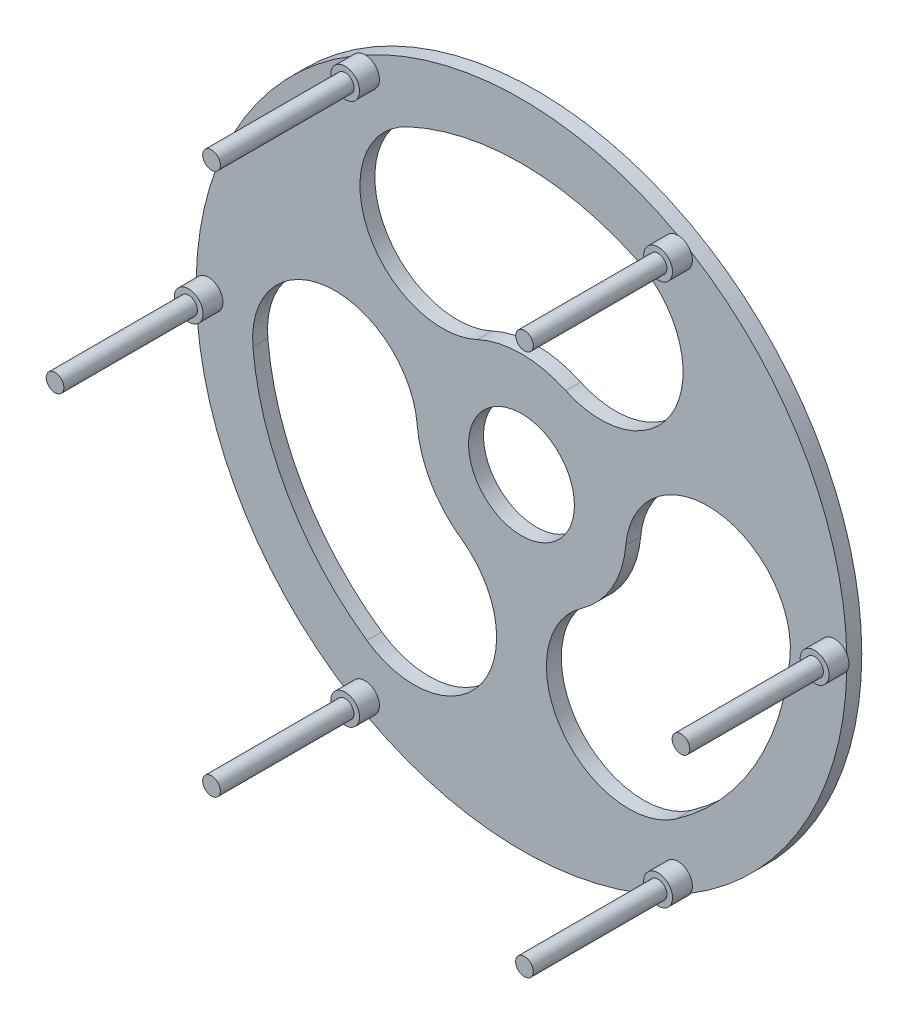
from build123d import *

# Parameters (mm, degrees)
SKETCH_1_R          = 65.5
EXTRUDE_1_DEPTH     = 3
SKETCH_2_R          = 2.9
EXTRUDE_2_DEPTH     = 4
SKETCH_3_R          = 10.65
CUT_EXTRUDE_1_DEPTH = 94.00032258
SKETCH_4_R          = 1.777177549
EXTRUDE_3_DEPTH     = 26.9
CUT_EXTRUDE_2_DEPTH = 98.917669498


with BuildPart() as part:
    # 草图1 → 凸台-拉伸1 (new body)
    with BuildSketch(Plane.XY):
        Circle(SKETCH_1_R)
    extrude(amount=-EXTRUDE_1_DEPTH)

    # 草图2 → 凸台-拉伸2 (add)
    with BuildSketch(Plane.XY):
        with Locations(Location((-63, 0, 0), (0, 0, 148.88786163))):
            Circle(SKETCH_2_R)
        with Locations(Location((-31.5, 54.559600438, 0), (0, 0, 151.11213837))):
            Circle(SKETCH_2_R)
        with Locations(Location((31.5, 54.559600438, 0), (0, 0, 91.11213837))):
            Circle(SKETCH_2_R)
        with Locations(Location((63, 0, 0), (0, 0, 31.11213837))):
            Circle(SKETCH_2_R)
        with Locations(Location((31.5, -54.559600438, 0), (0, 0, 268.88786163))):
            Circle(SKETCH_2_R)
        with Locations(Location((-31.5, -54.559600438, 0), (0, 0, 208.88786163))):
            Circle(SKETCH_2_R)
    extrude(amount=EXTRUDE_2_DEPTH)

    # 草图3 → 切除-拉伸1 (cut, through all)
    with BuildSketch(Plane.XY):
        Circle(SKETCH_3_R)
    extrude(amount=-CUT_EXTRUDE_1_DEPTH, mode=Mode.SUBTRACT)

    # 草图4 → 凸台-拉伸3 (add)
    with BuildSketch(Plane.XY.offset(4)):
        with Locations((-31.5, 54.559600438)):
            Circle(SKETCH_4_R)
        with Locations((31.5, 54.559600438)):
            Circle(SKETCH_4_R)
        with Locations((63, 0)):
            Circle(SKETCH_4_R)
        with Locations((31.5, -54.559600438)):
            Circle(SKETCH_4_R)
        with Locations((-31.5, -54.559600438)):
            Circle(SKETCH_4_R)
        with Locations((-63, 0)):
            Circle(SKETCH_4_R)
    extrude(amount=EXTRUDE_3_DEPTH)

    # 草图5 → 切除-拉伸2 (cut, through all)
    with BuildSketch(Plane.XY):
        with BuildLine():
            ThreePointArc((22.936143614, 49.18671871), (0, 54.27153933), (-22.936143614, 49.18671871))
            ThreePointArc((-22.936143614, 49.18671871), (-30.965446368, 27.126390699), (-8.905118357, 19.097087944))
            ThreePointArc((-8.905118357, 19.097087944), (0, 21.071305154), (8.905118357, 19.097087944))
            ThreePointArc((8.905118357, 19.097087944), (30.965446368, 27.126390699), (22.936143614, 49.18671871))
        make_face()
        with BuildLine():
            ThreePointArc((12.08600412, -17.260602693), (18.248285555, -10.535652577), (20.991122477, -1.836485251))
            ThreePointArc((20.991122477, -1.836485251), (38.974866642, 13.253667845), (54.065019738, -4.73007632))
            ThreePointArc((54.065019738, -4.73007632), (47.000531763, -27.135769665), (31.128876124, -44.456642389))
            ThreePointArc((31.128876124, -44.456642389), (8.009420274, -40.380058544), (12.08600412, -17.260602693))
        make_face()
        with BuildLine():
            ThreePointArc((-20.991122477, -1.836485251), (-18.248285555, -10.535652577), (-12.08600412, -17.260602693))
            ThreePointArc((-12.08600412, -17.260602693), (-8.009420274, -40.380058544), (-31.128876124, -44.456642389))
            ThreePointArc((-31.128876124, -44.456642389), (-47.000531763, -27.135769665), (-54.065019738, -4.73007632))
            ThreePointArc((-54.065019738, -4.73007632), (-38.974866642, 13.253667845), (-20.991122477, -1.836485251))
        make_face()
    extrude(amount=-CUT_EXTRUDE_2_DEPTH, mode=Mode.SUBTRACT)


solid = part.part
